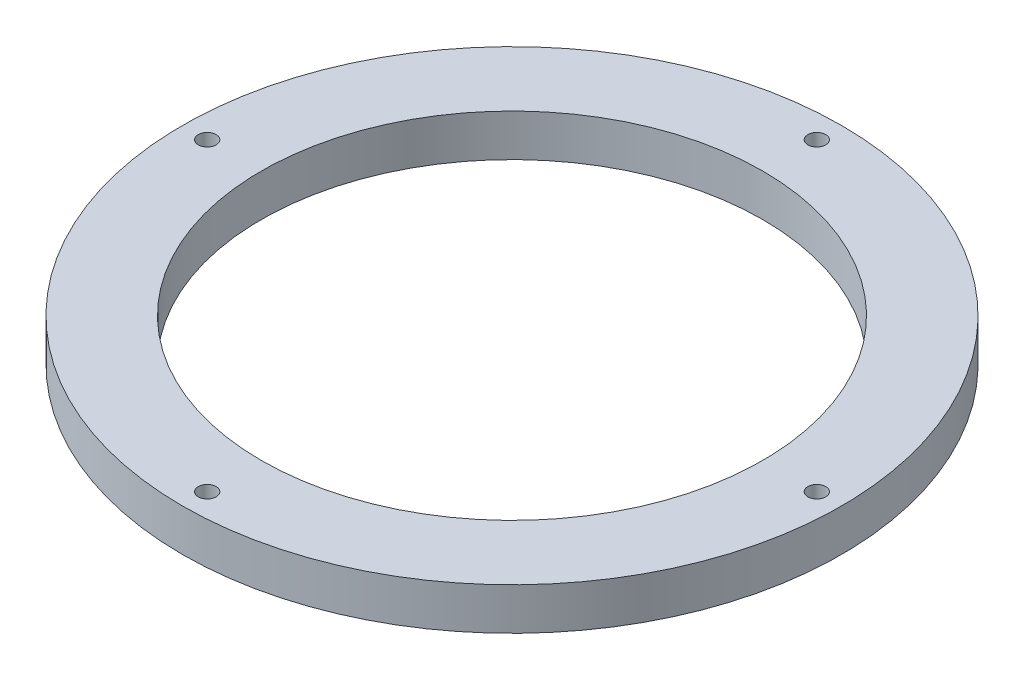
from build123d import *

# Parameters (mm, degrees)
SKETCH1_W                                     = 15
SKETCH1_H                                     = 8
CBORE_FOR_M3_HEX_HEAD_MACHINE_SCREW1_AT_COUNT = 2
CBORE_FOR_M3_HEX_HEAD_MACHINE_SCREW1_AT_PITCH = 81.99963788
CBORE_FOR_M3_HEX_HEAD_MACHINE_SCREW1_2_COUNT  = 2
CBORE_FOR_M3_HEX_HEAD_MACHINE_SCREW1_2_PITCH  = 81.99963788
CBORE_FOR_M3_HEX_HEAD_MACHINE_SCREW1_3_COUNT  = 2
CBORE_FOR_M3_HEX_HEAD_MACHINE_SCREW1_3_PITCH  = 115.965


with BuildPart() as part:
    # Sketch1 → Revolve1 (revolve)
    with BuildSketch(Plane.XY, mode=Mode.PRIVATE) as revolve1_sk:
        with Locations((55.1885, 4)):
            Rectangle(SKETCH1_W, SKETCH1_H)
    revolve(revolve1_sk.sketch.rotate(Axis((0, 0, 0), (0, 1, 0)), 90), axis=Axis((0, 0, 0), (0, 1, 0)))

    # Sketch3 → CBORE for M3 Hex Head Machine Screw1 (revolve, cut)
    with BuildSketch(Plane(origin=(0, 0, -57.9825), x_dir=(0, 0, -1), z_dir=(1, 0, 0))):
        Polygon((0, 0), (0, 8), (1.7, 8), (1.7, 2.3), (4.2, 2.3), (4.2, 0.025), (4.225, 0), align=None)
    cbore_for_m3_hex_head_machine_screw1 = revolve(axis=Axis((0, -6.35, -57.9825), (0, 1, 0)), mode=Mode.SUBTRACT)

    # CBORE for M3 Hex Head Machine Screw1 at: CBORE for M3 Hex Head Machine Screw1 ×2
    with Locations(*[Vector(0.7071067811865476, 0, 0.7071067811865476) * (i * CBORE_FOR_M3_HEX_HEAD_MACHINE_SCREW1_AT_PITCH) for i in range(1, CBORE_FOR_M3_HEX_HEAD_MACHINE_SCREW1_AT_COUNT)]):
        add(cbore_for_m3_hex_head_machine_screw1, mode=Mode.SUBTRACT)

    # CBORE for M3 Hex Head Machine Screw1 2: CBORE for M3 Hex Head Machine Screw1 ×2
    with Locations(*[Vector(-0.7071067811865476, 0, 0.7071067811865476) * (i * CBORE_FOR_M3_HEX_HEAD_MACHINE_SCREW1_2_PITCH) for i in range(1, CBORE_FOR_M3_HEX_HEAD_MACHINE_SCREW1_2_COUNT)]):
        add(cbore_for_m3_hex_head_machine_screw1, mode=Mode.SUBTRACT)

    # CBORE for M3 Hex Head Machine Screw1 3: CBORE for M3 Hex Head Machine Screw1 ×2
    with Locations(*[(0, 0, i * CBORE_FOR_M3_HEX_HEAD_MACHINE_SCREW1_3_PITCH) for i in range(1, CBORE_FOR_M3_HEX_HEAD_MACHINE_SCREW1_3_COUNT)]):
        add(cbore_for_m3_hex_head_machine_screw1, mode=Mode.SUBTRACT)


solid = part.part
